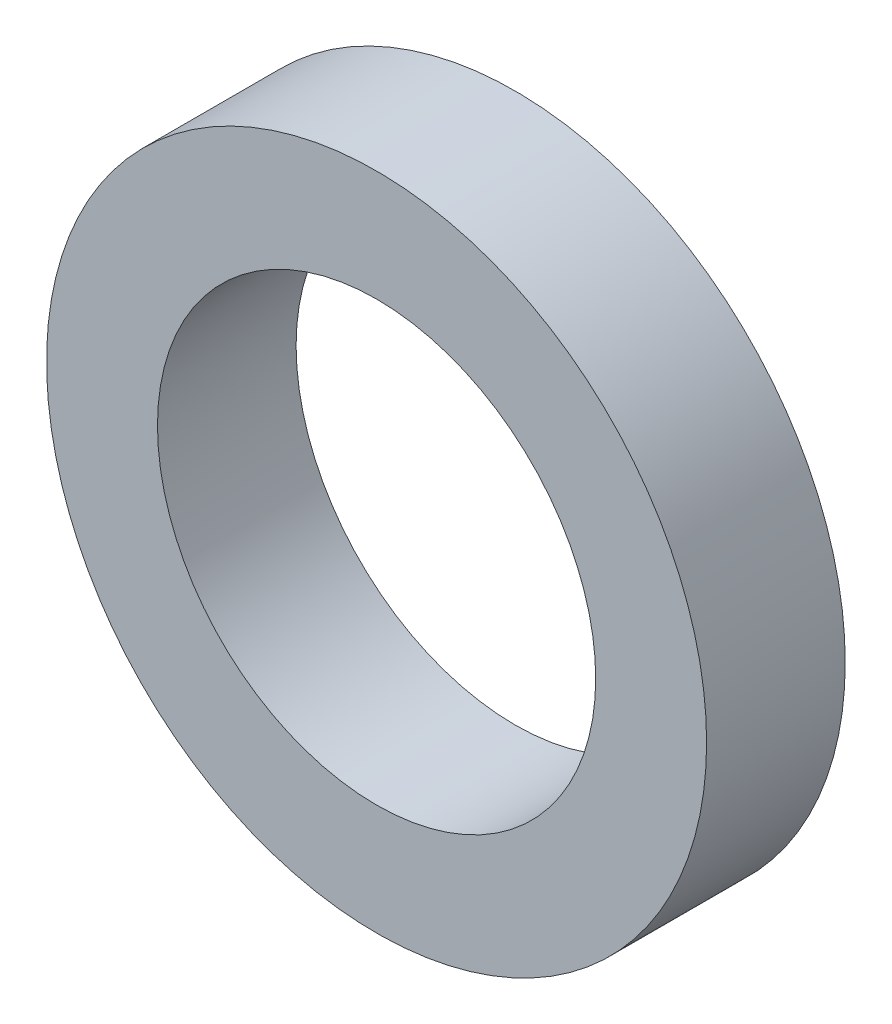
from build123d import *

# Parameters (mm, degrees)
SKETCH_1_R      = 11.903
SKETCH_1_R_2    = 7.903
EXTRUDE_1_DEPTH = 5


with BuildPart() as part:
    # Эскиз1 → Бобышка-Вытянуть1 (new body)
    with BuildSketch(Plane.XY):
        Circle(SKETCH_1_R)
        Circle(SKETCH_1_R_2, mode=Mode.SUBTRACT)
    extrude(amount=EXTRUDE_1_DEPTH)


solid = part.part
